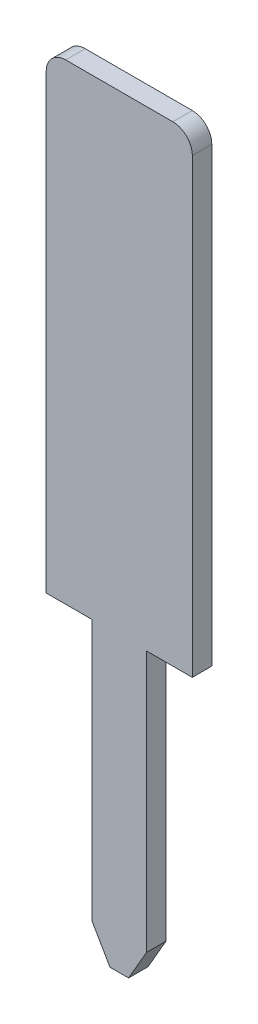
from build123d import *

# Parameters (mm, degrees)
BOSS_EXTRUDE1_DEPTH = 0.254
FILLET2_R           = 0.254


with BuildPart() as part:
    # Sketch1 → Boss-Extrude1 (new body)
    with BuildSketch(Plane.XY):
        Polygon((-49.105346889, -48.133448144), (-47.200346889, -48.133448144), (-47.200346889, -54.280248144), (-47.797246889, -54.280248144), (-47.797246889, -57.684193827), (-48.031682458, -58.090248144), (-48.27401132, -58.090248144), (-48.508446889, -57.684193827), (-48.508446889, -54.280248144), (-49.105346889, -54.280248144), align=None)
    extrude(amount=BOSS_EXTRUDE1_DEPTH)

    # Fillet2
    fillet2_edges = [part.edges().sort_by_distance(p)[0] for p in [
        (-49.105346889, -48.133448144, 0.127),
        (-47.200346889, -48.133448144, 0.127),
    ]]
    fillet(fillet2_edges, radius=FILLET2_R)


solid = part.part
